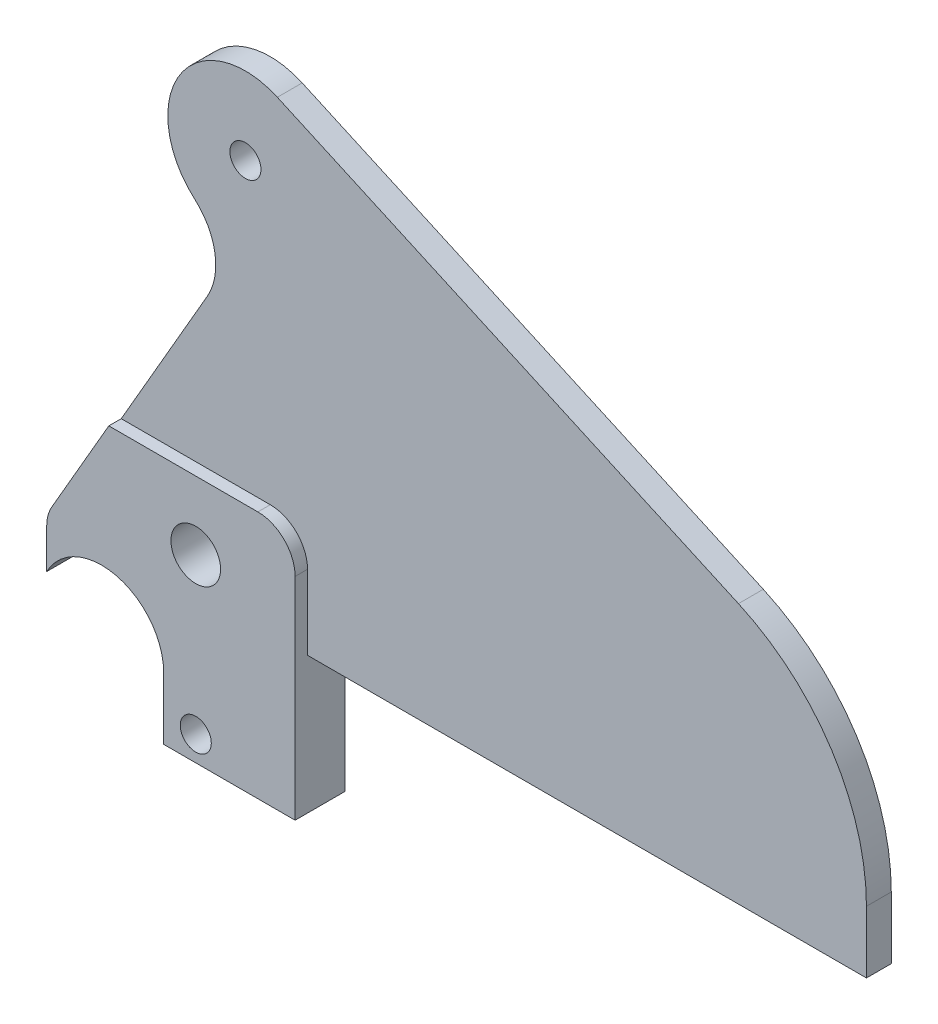
from build123d import *

# Parameters (mm, degrees)
SKETCH1_R           = 1.25
SKETCH1_R_2         = 2
BOSS_EXTRUDE1_DEPTH = 1
SKETCH1_3_R         = 1.25
SKETCH1_3_R_2       = 2
BOSS_EXTRUDE2_DEPTH = 2
FILLET1_R           = 3


with BuildPart() as part:
    # Sketch1 → Boss-Extrude1 (new, symmetric)
    with BuildSketch(Plane.XY):
        with BuildLine():
            Line((-2.581223152, 3), (-2.581223152, -2))
            Line((-2.581223152, -2), (8, -2))
            Line((8, -2), (8, 9))
            Line((8, 9), (53, 9))
            Line((53, 9), (53, 14))
            ThreePointArc((53, 14), (50.1997341, 23.495673614), (42.695106585, 29.952443112))
            Line((42.695106585, 29.952443112), (5.569680923, 46.697301111))
            ThreePointArc((5.569680923, 46.697301111), (-2.260977773, 44.374109196), (-1.106198045, 36.288138625))
            ThreePointArc((-1.106198045, 36.288138625), (0.540780767, 33.340838667), (-0.061029462, 30.018649525))
            Line((-0.061029462, 30.018649525), (-12, 9.339745962))
            Line((-12, 9.339745962), (-12, 5.339745962))
            ThreePointArc((-12, 5.339745962), (-6.375794647, 7.852519152), (-2.581223152, 3))
        make_face()
        Circle(SKETCH1_R, mode=Mode.SUBTRACT)
        with Locations((0, 12.5)):
            Circle(SKETCH1_R_2, mode=Mode.SUBTRACT)
        with Locations((3, 41)):
            Circle(SKETCH1_R, mode=Mode.SUBTRACT)
    extrude(amount=BOSS_EXTRUDE1_DEPTH, both=True)

    # Sketch1<3> → Boss-Extrude2 (add, symmetric)
    with BuildSketch(Plane.XY):
        with BuildLine():
            Line((-2.581223152, 3), (-2.581223152, -2))
            Line((-2.581223152, -2), (8, -2))
            Line((8, -2), (8, 9))
            Line((8, 9), (8, 18))
            Line((8, 18), (-7, 18))
            Line((-7, 18), (-12, 9.339745962))
            Line((-12, 9.339745962), (-12, 5.339745962))
            ThreePointArc((-12, 5.339745962), (-6.375794647, 7.852519152), (-2.581223152, 3))
        make_face()
        Circle(SKETCH1_3_R, mode=Mode.SUBTRACT)
        with Locations((0, 12.5)):
            Circle(SKETCH1_3_R_2, mode=Mode.SUBTRACT)
    extrude(amount=BOSS_EXTRUDE2_DEPTH, both=True)

    # Fillet1
    fillet1_edges = [part.edges().sort_by_distance(p)[0] for p in [
        (-12, 9.339745962, 0),
        (8, 18, -1.5),
        (8, 18, 1.5),
    ]]
    fillet(fillet1_edges, radius=FILLET1_R)


solid = part.part
